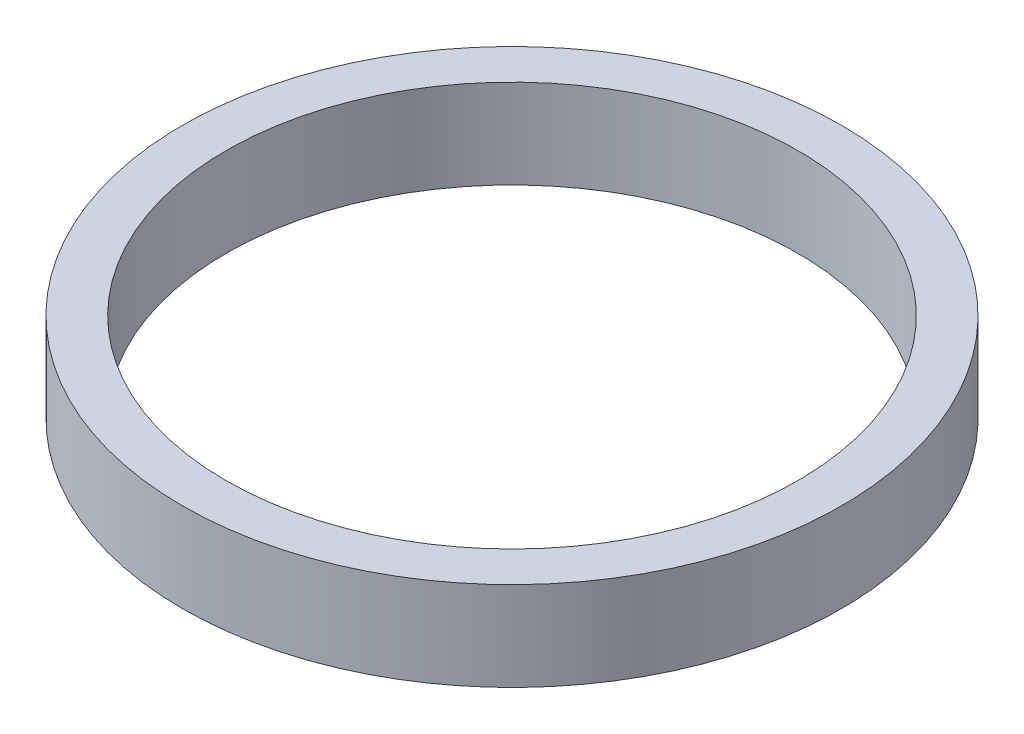
from build123d import *

# Parameters (mm, degrees)
SKETCH2_R           = 18.5
SKETCH2_R_2         = 16.05
BOSS_EXTRUDE1_DEPTH = 5


with BuildPart() as part:
    # Sketch2 → Boss-Extrude1 (new body)
    with BuildSketch(Plane(origin=(0, 9, 0), x_dir=(1, 0, 0), z_dir=(0, 1, 0))):
        with Locations(Location((-0.5, 0, 0), (0, 0, 270))):
            Circle(SKETCH2_R)
        with Locations(Location((-0.5, 0, 0), (0, 0, 270))):
            Circle(SKETCH2_R_2, mode=Mode.SUBTRACT)
    extrude(amount=BOSS_EXTRUDE1_DEPTH)


solid = part.part
